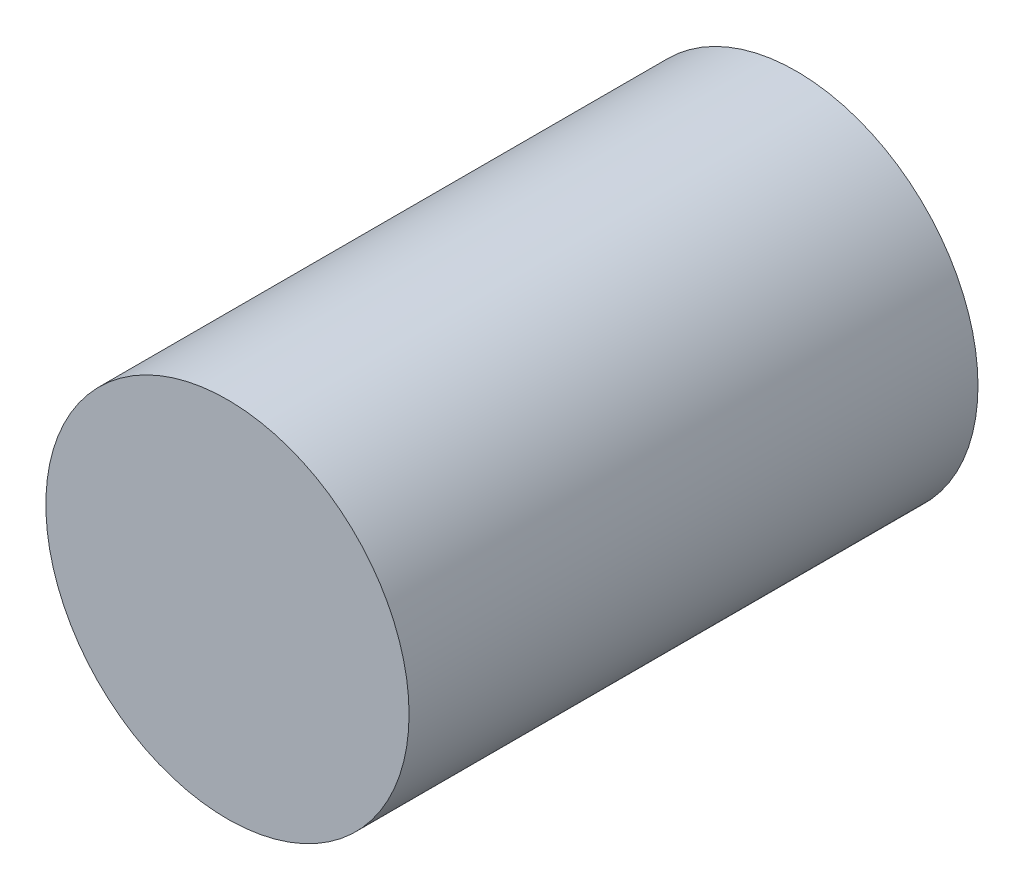
from build123d import *

# Parameters (mm, degrees)
SKETCH1_R           = 4.67
BOSS_EXTRUDE1_DEPTH = 14.63


with BuildPart() as part:
    # Sketch1 → Boss-Extrude1 (new body)
    with BuildSketch(Plane.XY):
        Circle(SKETCH1_R)
    extrude(amount=BOSS_EXTRUDE1_DEPTH)


solid = part.part
